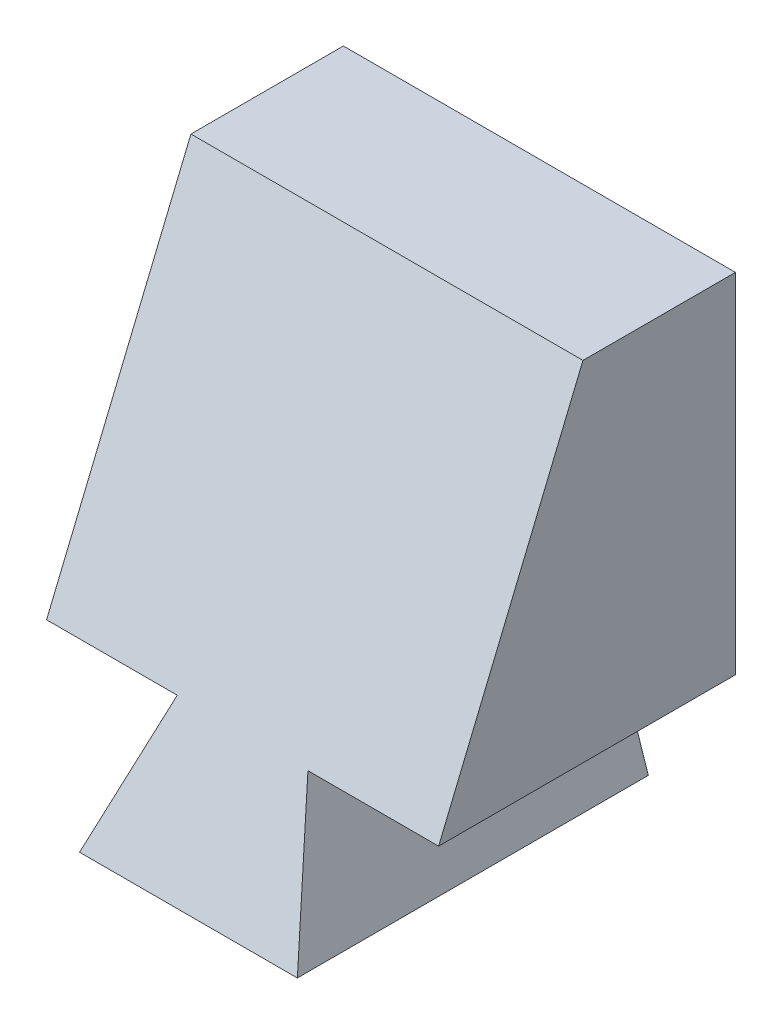
from build123d import *

# Parameters (mm, degrees)
BOSS_EXTRUDE1_DEPTH     = 10
CUT_EXTRUDE1_DEPTH      = 18.007618008
CUT_EXTRUDE1_DEPTH_BACK = 18.007618008


with BuildPart() as part:
    # Sketch2 → Boss-Extrude1 (new body)
    with BuildSketch(Plane.XY):
        Polygon((0.796949894, 2.404761905), (-2.203050106, 2.404761905), (-2.203050106, 10.404761905), (6.796949894, 10.404761905), (6.796949894, 2.404761905), (3.796949894, 2.404761905), (4.796949894, -0.595238095), (-0.203050106, -0.595238095), align=None)
    extrude(amount=BOSS_EXTRUDE1_DEPTH)

    # Sketch3 → Cut-Extrude1 (cut, two sides: drawn at the far end of the back side and taken through both)
    with BuildSketch(Plane(origin=(6.796949894, 0, 0), x_dir=(0, 0, -1), z_dir=(1, 0, 0)).offset(-CUT_EXTRUDE1_DEPTH_BACK)):
        Polygon((-3.5, 10.404761905), (-10, 10.404761905), (-10, 2.404761905), (-6.813708499, 2.404761905), align=None)
        Polygon((-6.813708499, 2.404761905), (-10, 2.404761905), (-10, -0.595238095), (-8.056349186, -0.595238095), align=None)
    extrude(amount=CUT_EXTRUDE1_DEPTH + CUT_EXTRUDE1_DEPTH_BACK, mode=Mode.SUBTRACT)


solid = part.part
